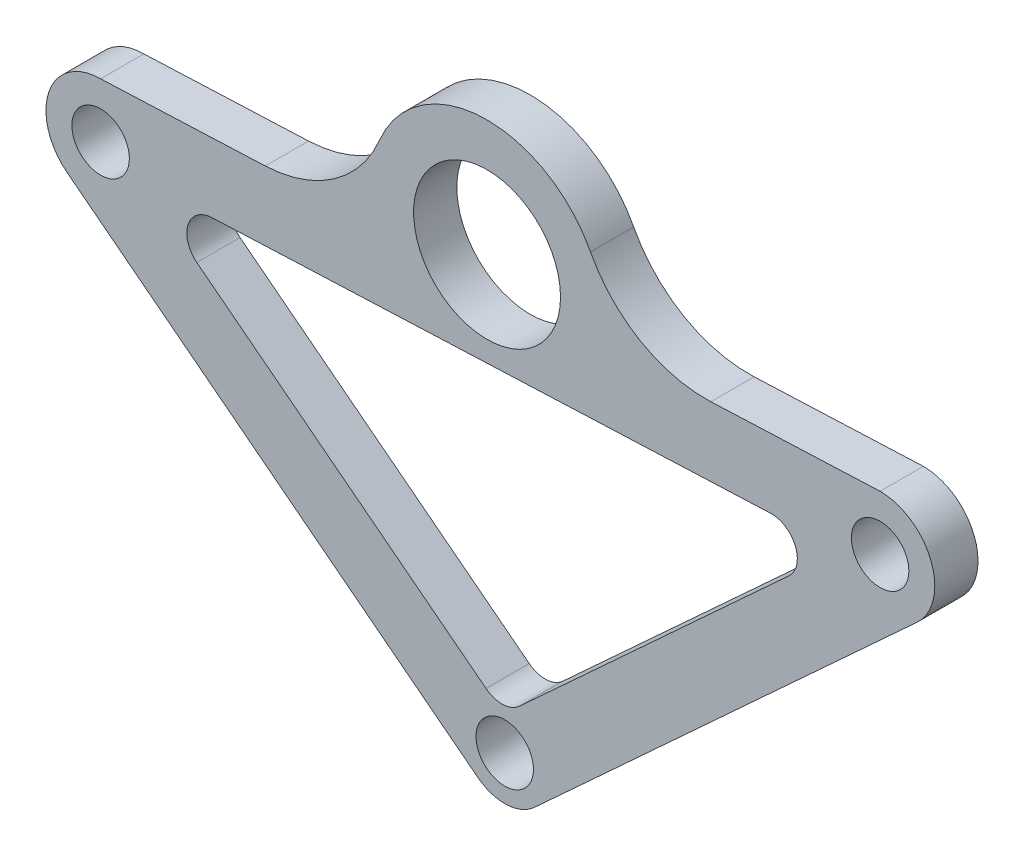
from build123d import *

# Parameters (mm, degrees)
SKETCH1_R           = 3.325
SKETCH1_R_2         = 8.5
BOSS_EXTRUDE1_DEPTH = 2.5


with BuildPart() as part:
    # Sketch1 → Boss-Extrude1 (new, symmetric)
    with BuildSketch(Plane.XY):
        with BuildLine():
            ThreePointArc((60.622067271, 14.206532436), (59.125498335, 14.810906809), (57.524692071, 15.016834632))
            Line((57.524692071, 15.016834632), (56.997116089, 14.994793348))
            Line((56.997116089, 14.994793348), (37.942484943, 14.198721238))
            ThreePointArc((37.942484943, 14.198721238), (29.810784304, 16.198484397), (24.018273447, 22.245833067))
            ThreePointArc((24.018273447, 22.245833067), (11.4864831, 29.488233713), (-0.397539124, 21.225779345))
            ThreePointArc((-0.397539124, 21.225779345), (-5.665447564, 14.71634399), (-13.602008261, 12.045274491))
            Line((-13.602008261, 12.045274491), (-32.656639407, 11.249202381))
            ThreePointArc((-32.656639407, 11.249202381), (-35.431571333, 10.60798438), (-37.643867273, 8.81434161))
            ThreePointArc((-37.643867273, 8.81434161), (-38.932803958, 4.139738531), (-36.53293032, -0.073796594))
            Line((-36.53293032, -0.073796594), (10.980057512, -36.923376572))
            ThreePointArc((10.980057512, -36.923376572), (14.305396611, -37.984745832), (17.530617501, -36.649704619))
            Line((17.530617501, -36.649704619), (61.804364137, 4.034578786))
            ThreePointArc((61.804364137, 4.034578786), (63.807395856, 9.422079897), (60.622067271, 14.206532436))
        make_face()
        with Locations((14.093347289, -32.909173442)):
            Circle(SKETCH1_R, mode=Mode.SUBTRACT)
        with BuildLine():
            Line((-19.81205116, 3.778850103), (44.820399723, 6.479090855))
            ThreePointArc((44.820399723, 6.479090855), (47.71753436, 4.629103679), (46.975509685, 1.272730481))
            Line((46.975509685, 1.272730481), (15.799754589, -27.375471944))
            ThreePointArc((15.799754589, -27.375471944), (13.895096583, -28.163882109), (11.93131365, -27.537089238))
            Line((11.93131365, -27.537089238), (-21.525382137, -1.589127566))
            ThreePointArc((-21.525382137, -1.589127566), (-22.544780206, 1.693656197), (-19.81205116, 3.778850103))
        make_face(mode=Mode.SUBTRACT)
        with Locations((-32.656639407, 4.924202381)):
            Circle(SKETCH1_R, mode=Mode.SUBTRACT)
        with Locations((12.05, 16)):
            Circle(SKETCH1_R_2, mode=Mode.SUBTRACT)
        with Locations((57.524692071, 8.691834632)):
            Circle(SKETCH1_R, mode=Mode.SUBTRACT)
    extrude(amount=BOSS_EXTRUDE1_DEPTH, both=True)


solid = part.part
